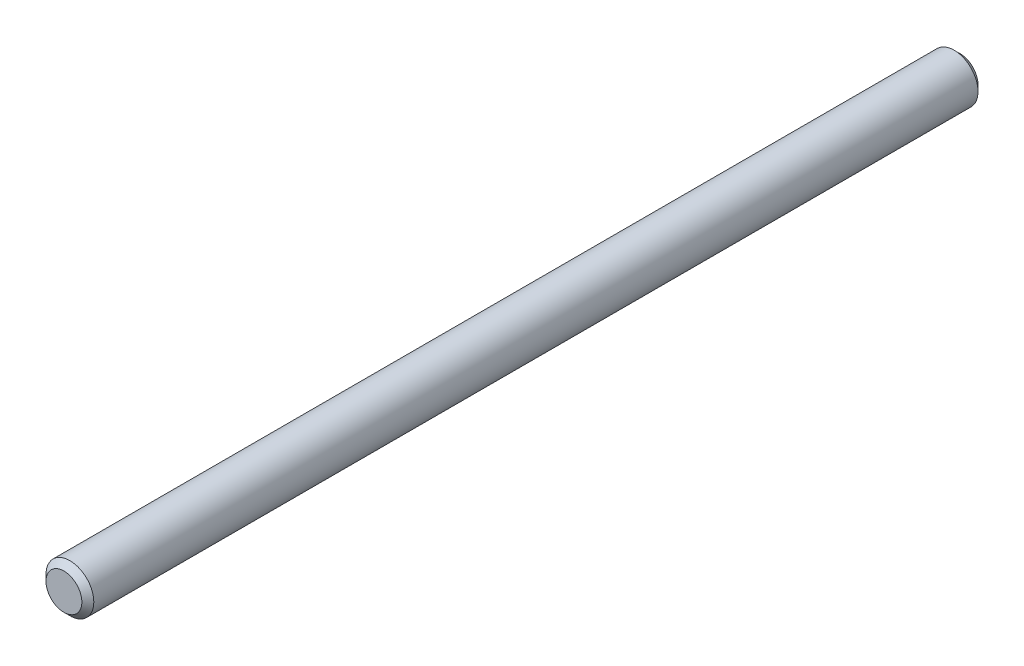
from build123d import *

# Parameters (mm, degrees)
SKETCH1_R           = 4
BOSS_EXTRUDE1_DEPTH = 150
CHAMFER1_SIZE       = 1


with BuildPart() as part:
    # Sketch1 → Boss-Extrude1 (new body)
    with BuildSketch(Plane.XY):
        Circle(SKETCH1_R)
    extrude(amount=BOSS_EXTRUDE1_DEPTH)

    # Chamfer1
    chamfer1_edges = [part.edges().sort_by_distance(p)[0] for p in [
        (-4, 0, 0),
        (-4, 0, 150),
    ]]
    chamfer(chamfer1_edges, length=CHAMFER1_SIZE)


solid = part.part
